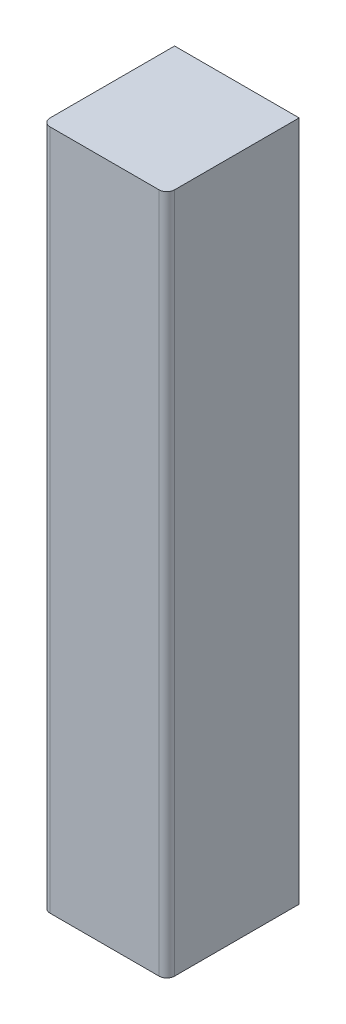
from build123d import *

# Parameters (mm, degrees)
SKETCH_1_W      = 16
SKETCH_1_H      = 87.5
EXTRUDE_1_DEPTH = 0.1
SKETCH_2_W      = 16
SKETCH_2_H      = 87.5
EXTRUDE_2_DEPTH = 16.9
FILLET_1_R      = 1


with BuildPart() as part:
    # 草图1 → 拉伸1 (new body)
    with BuildSketch(Plane.XY):
        Rectangle(SKETCH_1_W, SKETCH_1_H)
    extrude(amount=EXTRUDE_1_DEPTH)

    # 草图2 → 拉伸2 (add)
    with BuildSketch(Plane.XY.offset(0.1)):
        Rectangle(SKETCH_2_W, SKETCH_2_H)
    extrude(amount=EXTRUDE_2_DEPTH)

    # 圆角1
    fillet_1_edges = [part.edges().sort_by_distance(p)[0] for p in [
        (-8, 0, 17),
        (8, 0, 17),
    ]]
    fillet(fillet_1_edges, radius=FILLET_1_R)


solid = part.part
